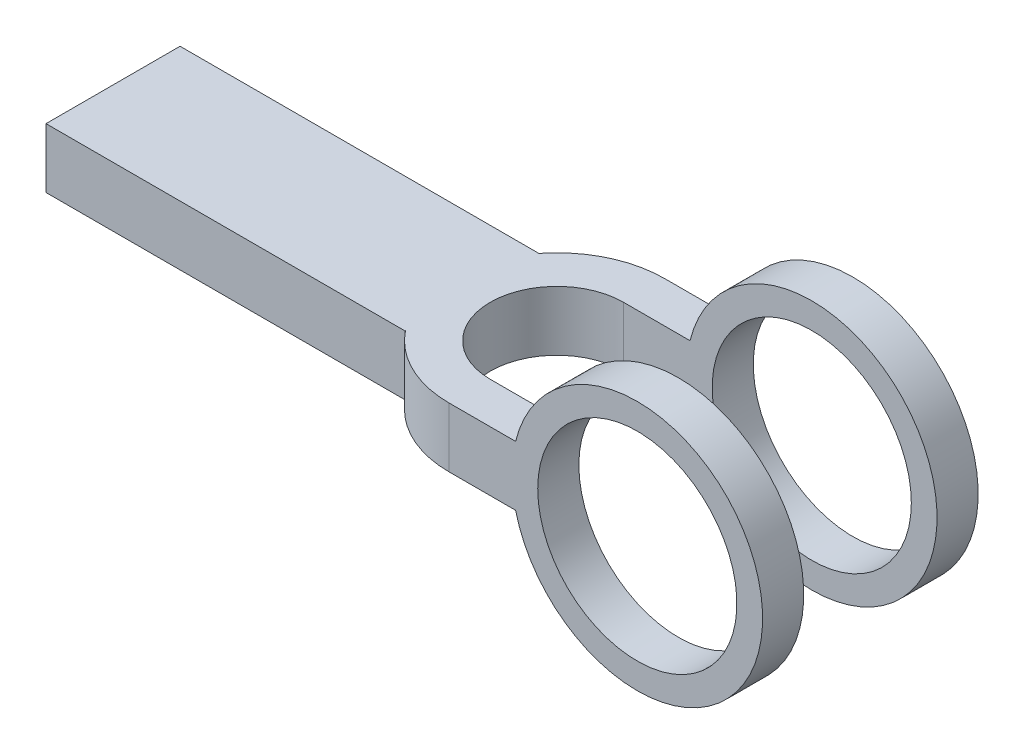
from build123d import *

# Parameters (mm, degrees)
BOSS_EXTRUDE1_DEPTH = 21
SKETCH2_R           = 44.092659675
SKETCH2_R_2         = 35.039506693
BOSS_EXTRUDE2_DEPTH = 14.465745569
BOSS_EXTRUDE3_START = -14.465745569
SKETCH4_R           = 44.092659675
SKETCH4_R_2         = 35.039506693
BOSS_EXTRUDE3_DEPTH = 14.465745569


with BuildPart() as part:
    # Sketch1 → Boss-Extrude1 (new body)
    with BuildSketch(Plane(origin=(0, 0, 0), x_dir=(1, 0, 0), z_dir=(0, 1, 0))):
        with BuildLine():
            Line((0, 37.924000209), (23.712323124, 37.924000209))
            Line((23.712323124, 37.924000209), (23.712323124, 23.45825464))
            Line((23.712323124, 23.45825464), (0, 23.45825464))
            ThreePointArc((0, 23.45825464), (-23.45825464, 0), (0, -23.45825464))
            Line((0, -23.45825464), (23.712323124, -23.45825464))
            Line((23.712323124, -23.45825464), (23.712323124, -37.924000209))
            Line((23.712323124, -37.924000209), (0, -37.924000209))
            ThreePointArc((0, -37.924000209), (-16.561988679, -34.116423067), (-29.798323461, -23.45825464))
            Line((-29.798323461, -23.45825464), (-29.798323461, -23.712323124))
            Line((-29.798323461, -23.712323124), (-156.054398777, -23.712323124))
            Line((-156.054398777, -23.712323124), (-156.054398777, 23.45825464))
            Line((-156.054398777, 23.45825464), (-29.798323461, 23.45825464))
            ThreePointArc((-29.798323461, 23.45825464), (-16.561988679, 34.116423067), (0, 37.924000209))
        make_face()
    extrude(amount=BOSS_EXTRUDE1_DEPTH)

    # Sketch2 → Boss-Extrude2 (add)
    with BuildSketch(Plane.XY.offset(-23.45825464)):
        with Locations((66.225280873, 10.5)):
            Circle(SKETCH2_R)
        with Locations((66.225280873, 10.5)):
            Circle(SKETCH2_R_2, mode=Mode.SUBTRACT)
    extrude(amount=-BOSS_EXTRUDE2_DEPTH)

    # Sketch4 → Boss-Extrude3 (add)
    with BuildSketch(Plane(origin=(0, 0, 23.45825464), x_dir=(-1, 0, 0), z_dir=(0, 0, -1)).offset(BOSS_EXTRUDE3_START)):
        with Locations((-66.225280873, 10.5)):
            Circle(SKETCH4_R)
        with Locations(Location((-66.225280873, 10.5, 0), (0, 0, 180))):
            Circle(SKETCH4_R_2, mode=Mode.SUBTRACT)
    extrude(amount=BOSS_EXTRUDE3_DEPTH)


solid = part.part
